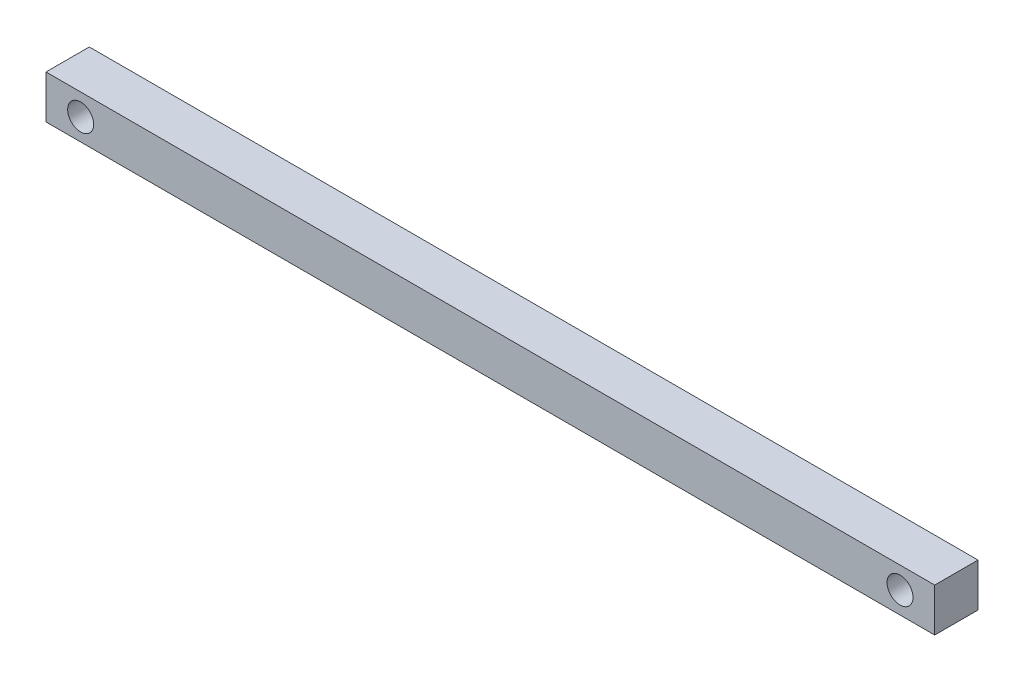
from build123d import *

# Parameters (mm, degrees)
SKETCH1_W           = 513
SKETCH1_H           = 25
SKETCH1_R           = 7.5
BOSS_EXTRUDE1_DEPTH = 25


with BuildPart() as part:
    # Sketch1 → Boss-Extrude1 (new body)
    with BuildSketch(Plane.XY):
        Rectangle(SKETCH1_W, SKETCH1_H)
        with Locations((-236.5, 0)):
            Circle(SKETCH1_R, mode=Mode.SUBTRACT)
        with Locations((236.5, 0)):
            Circle(SKETCH1_R, mode=Mode.SUBTRACT)
    extrude(amount=BOSS_EXTRUDE1_DEPTH)


solid = part.part
